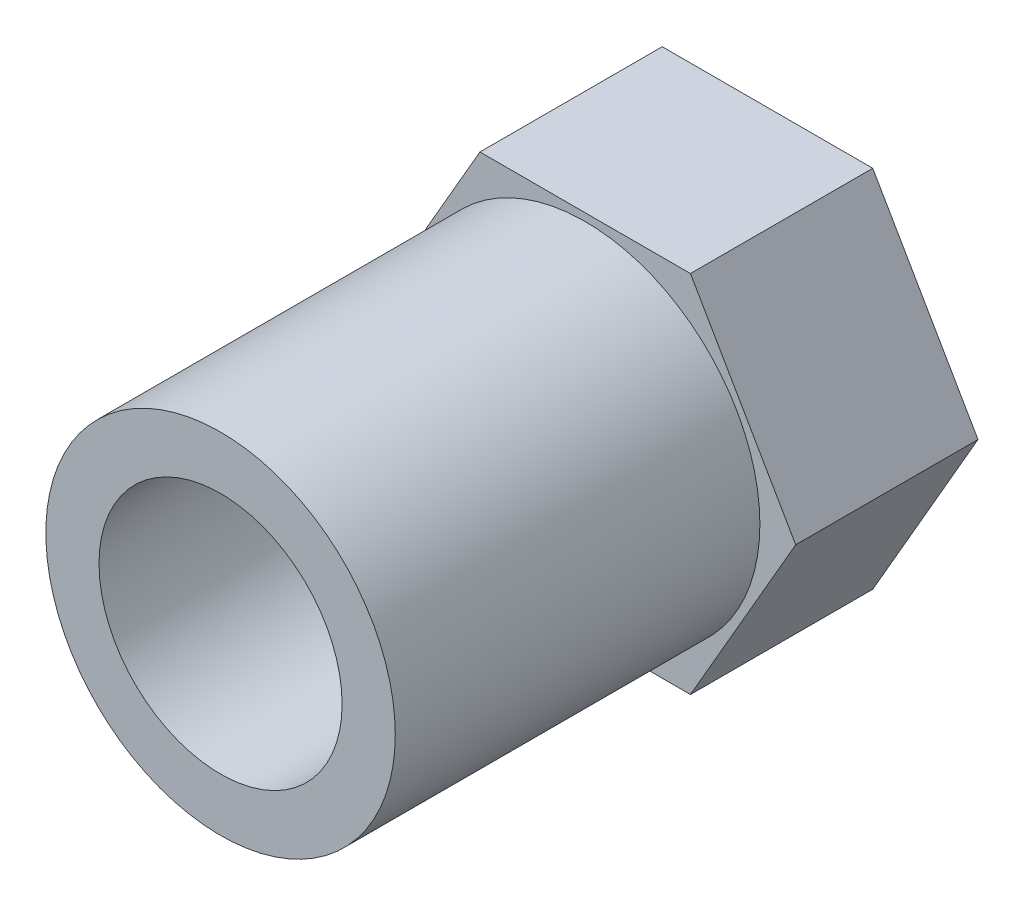
from build123d import *

# Parameters (mm, degrees)
SKETCH2_R             = 5.75
SKETCH2_R_2           = 4
BOSS_EXTRUDE1_DEPTH   = 12
BOSS_EXTRUDE2_DEPTH   = 6
M4X0_7_TAPPED_HOLE1_D = 3.3


with BuildPart() as part:
    # Sketch2 → Boss-Extrude1 (new body)
    with BuildSketch(Plane.XY):
        Circle(SKETCH2_R)
        Circle(SKETCH2_R_2, mode=Mode.SUBTRACT)
    extrude(amount=BOSS_EXTRUDE1_DEPTH)

    # Sketch3 → Boss-Extrude2 (add)
    with BuildSketch(Plane.XY):
        Polygon((-6.92820323, 0), (-3.464101615, 6), (3.464101615, 6), (6.92820323, 0), (3.464101615, -6), (-3.464101615, -6), align=None)
    extrude(amount=-BOSS_EXTRUDE2_DEPTH)

    # M4x0.7 Tapped Hole1 (through all)
    with Locations(Plane(origin=(0, 0, -6), x_dir=(-1, 0, 0), z_dir=(0, 0, -1))):
        with Locations((0, 0)):
            Hole(M4X0_7_TAPPED_HOLE1_D / 2)


solid = part.part
